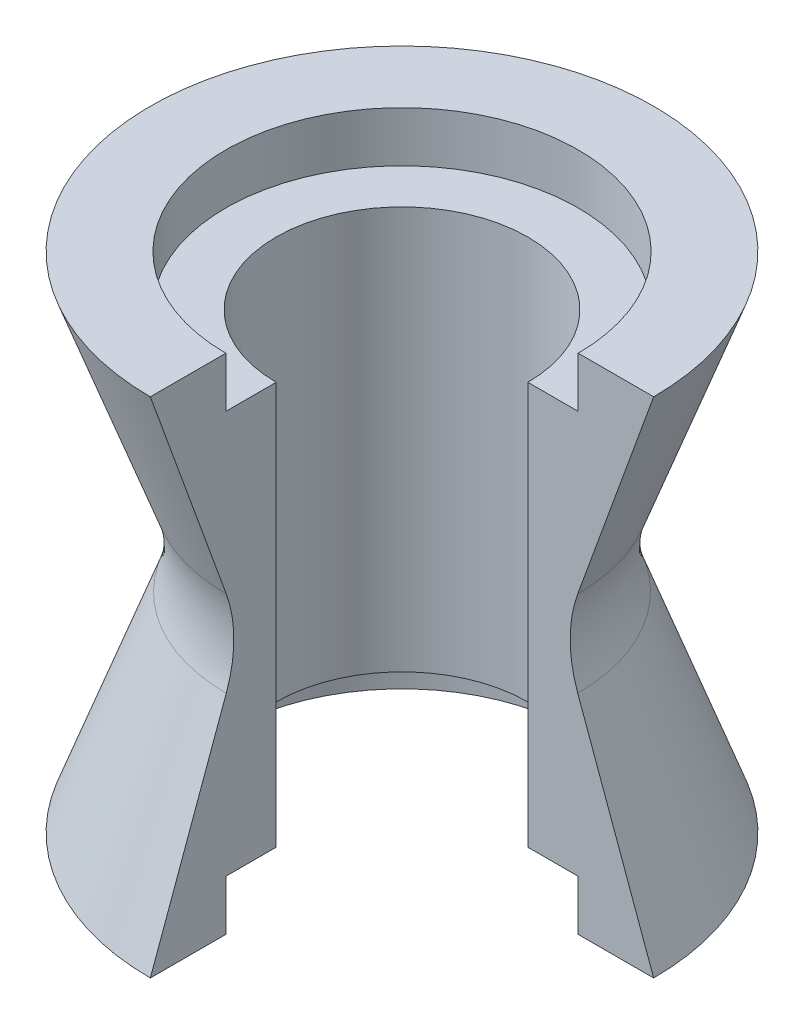
from build123d import *

# Parameters (mm, degrees)
SKETCH1_R               = 50
BOSS_EXTRUDE1_DEPTH     = 50
BOSS_EXTRUDE1_TAPER     = 20
CUT_EXTRUDE1_DEPTH      = 123.474487302
CUT_EXTRUDE1_DEPTH_BACK = 123.474487302
SKETCH2_R               = 25
SKETCH3_R               = 35
CUT_EXTRUDE2_DEPTH      = 10
CUT_EXTRUDE5_START      = -10
SKETCH5_R               = 35
CUT_EXTRUDE5_DEPTH      = 10
FILLET1_R               = 25
CUT_EXTRUDE6_DEPTH      = 123.474487302
CUT_EXTRUDE6_DEPTH_BACK = 123.474487302


with BuildPart() as part:
    # Sketch1 → Boss-Extrude1 (new body)
    with BuildSketch(Plane(origin=(0, 0, 0), x_dir=(1, 0, 0), z_dir=(0, 1, 0))):
        Circle(SKETCH1_R)
    boss_extrude1 = extrude(amount=BOSS_EXTRUDE1_DEPTH, taper=BOSS_EXTRUDE1_TAPER)

    # Mirror2: Boss-Extrude1 across plane
    add(boss_extrude1.mirror(Plane.ZX.offset(50)))

    # Sketch2 → Cut-Extrude1 (cut, two sides: drawn at the far end of the back side and taken through both)
    with BuildSketch(Plane(origin=(0, 100, 0), x_dir=(1, 0, 0), z_dir=(0, 1, 0)).offset(-CUT_EXTRUDE1_DEPTH_BACK)):
        with Locations(Location((0, 0, 0), (0, 0, 270))):
            Circle(SKETCH2_R)
    extrude(amount=CUT_EXTRUDE1_DEPTH + CUT_EXTRUDE1_DEPTH_BACK, mode=Mode.SUBTRACT)

    # Sketch3 → Cut-Extrude2 (cut)
    with BuildSketch(Plane(origin=(0, 100, 0), x_dir=(1, 0, 0), z_dir=(0, 1, 0))):
        with Locations(Location((0, 0, 0), (0, 0, 270))):
            Circle(SKETCH3_R)
    extrude(amount=-CUT_EXTRUDE2_DEPTH, mode=Mode.SUBTRACT)

    # Sketch5 → Cut-Extrude5 (cut)
    with BuildSketch(Plane.XZ.offset(CUT_EXTRUDE5_START)):
        with Locations(Location((0, 0, 0), (0, 0, 90))):
            Circle(SKETCH5_R)
    extrude(amount=CUT_EXTRUDE5_DEPTH, mode=Mode.SUBTRACT)

    # Fillet1
    fillet1_edges = [part.edges().sort_by_distance(p)[0] for p in [
        (-31.801488287, 50, 0),
    ]]
    fillet(fillet1_edges, radius=FILLET1_R)

    # Sketch7 → Cut-Extrude6 (cut, two sides: drawn at the far end of the back side and taken through both)
    with BuildSketch(Plane(origin=(0, 100, 0), x_dir=(1, 0, 0), z_dir=(0, 1, 0)).offset(-CUT_EXTRUDE6_DEPTH_BACK)):
        with BuildLine():
            Line((0, -50), (0, 0))
            Line((0, 0), (50, 0))
            ThreePointArc((50, 0), (35.355339059, -35.355339059), (0, -50))
        make_face()
    extrude(amount=CUT_EXTRUDE6_DEPTH + CUT_EXTRUDE6_DEPTH_BACK, mode=Mode.SUBTRACT)


solid = part.part
